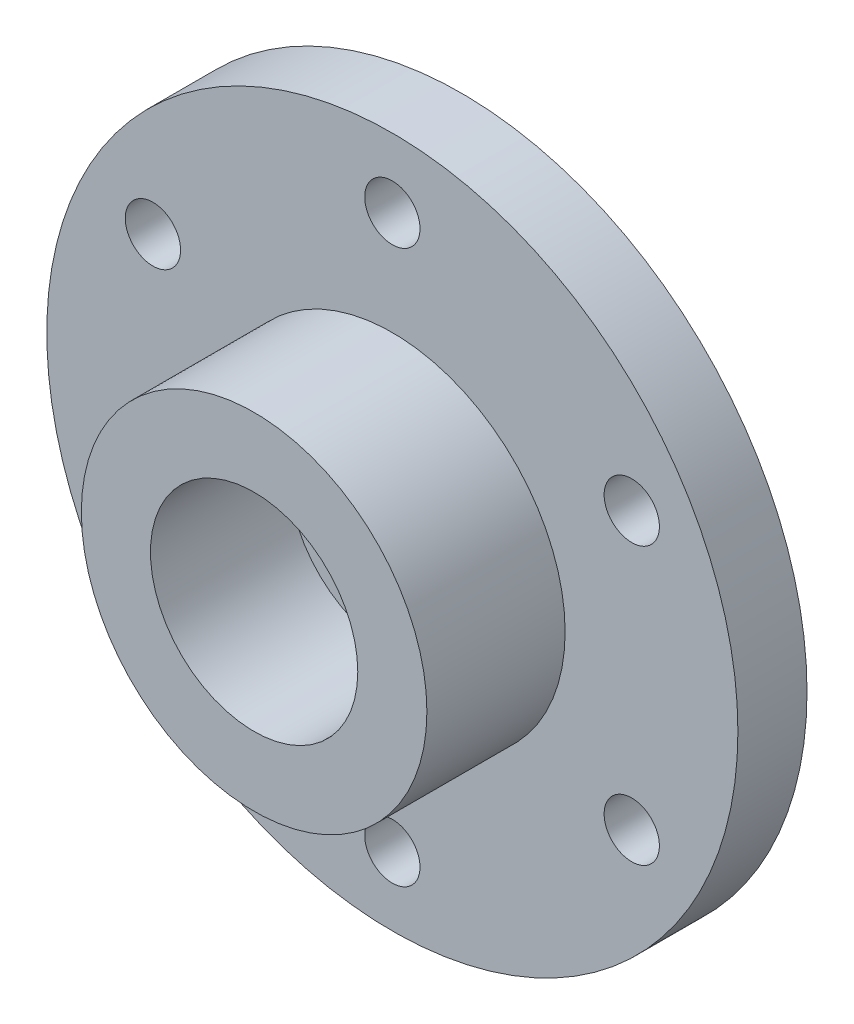
from build123d import *

# Parameters (mm, degrees)
SKETCH1_R           = 25
SKETCH1_R_2         = 2
BOSS_EXTRUDE1_DEPTH = 5
SKETCH2_R           = 12.5
SKETCH2_R_2         = 7.5
BOSS_EXTRUDE2_DEPTH = 10


with BuildPart() as part:
    # Sketch1 → Boss-Extrude1 (new body)
    with BuildSketch(Plane.XY):
        Circle(SKETCH1_R)
        with Locations((0, 20)):
            Circle(SKETCH1_R_2, mode=Mode.SUBTRACT)
        with Locations((17.320508076, 10)):
            Circle(SKETCH1_R_2, mode=Mode.SUBTRACT)
        with Locations((17.320508076, -10)):
            Circle(SKETCH1_R_2, mode=Mode.SUBTRACT)
        with Locations((0, -20)):
            Circle(SKETCH1_R_2, mode=Mode.SUBTRACT)
        with Locations((-17.320508076, -10)):
            Circle(SKETCH1_R_2, mode=Mode.SUBTRACT)
        with Locations((-17.320508076, 10)):
            Circle(SKETCH1_R_2, mode=Mode.SUBTRACT)
    extrude(amount=BOSS_EXTRUDE1_DEPTH)

    # Sketch2 → Boss-Extrude2 (add)
    with BuildSketch(Plane.XY.offset(5)):
        Circle(SKETCH2_R)
        Circle(SKETCH2_R_2, mode=Mode.SUBTRACT)
    extrude(amount=BOSS_EXTRUDE2_DEPTH)


solid = part.part
